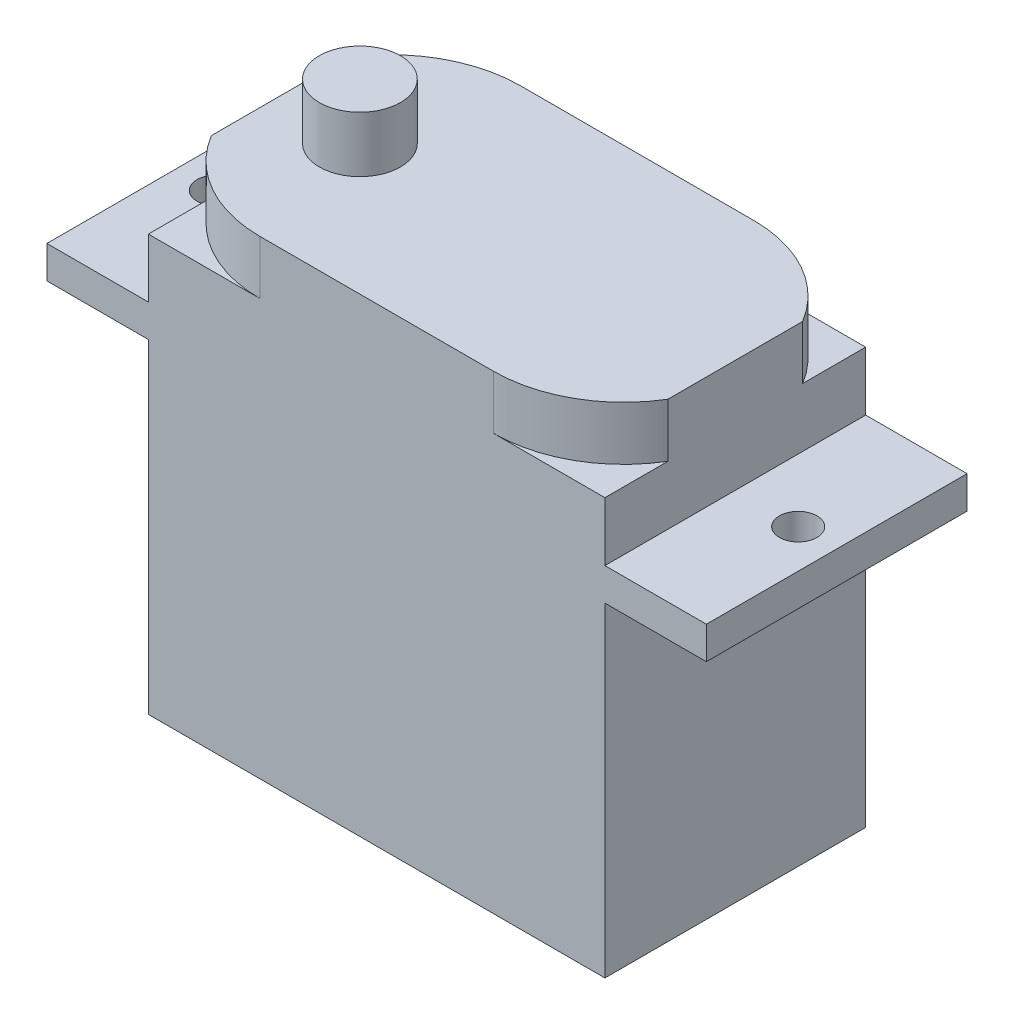
from build123d import *

# Parameters (mm, degrees)
ESQUISSE1_W      = 22.5
ESQUISSE1_H      = 20.5
EXTRUSION1_DEPTH = 12.85
EXTRUSION2_DEPTH = 2.65
ESQUISSE3_W      = 12.85
ESQUISSE3_H      = 1.6
EXTRUSION3_DEPTH = 5
ESQUISSE5_R      = 0.925
EXTRUSION5_DEPTH = 2.75
ESQUISSE4_R      = 2
EXTRUSION4_DEPTH = 2.75


with BuildPart() as part:
    # Esquisse1 → Extrusion1 (new body)
    with BuildSketch(Plane.XY):
        Rectangle(ESQUISSE1_W, ESQUISSE1_H)
    extrude(amount=EXTRUSION1_DEPTH)

    # Esquisse2 → Extrusion2 (add)
    with BuildSketch(Plane(origin=(0, 10.25, 0), x_dir=(1, 0, 0), z_dir=(0, 1, 0))):
        with BuildLine():
            Line((-5.75, 0), (5.75, 0))
            ThreePointArc((5.75, 0), (8.907662728, -0.829484734), (11.25, -3.103761526))
            Line((11.25, -3.103761526), (11.25, -9.746238474))
            ThreePointArc((11.25, -9.746238474), (8.907662728, -12.020515266), (5.75, -12.85))
            Line((5.75, -12.85), (-5.75, -12.85))
            ThreePointArc((-5.75, -12.85), (-8.907662728, -12.020515266), (-11.25, -9.746238474))
            Line((-11.25, -9.746238474), (-11.25, -3.103761526))
            ThreePointArc((-11.25, -3.103761526), (-8.907662728, -0.829484734), (-5.75, 0))
        make_face()
    extrude(amount=EXTRUSION2_DEPTH)

    # Esquisse3 → Extrusion3 (add)
    with BuildSketch(Plane.ZY.offset(11.25)):
        with Locations((6.425, 6.55)):
            Rectangle(ESQUISSE3_W, ESQUISSE3_H)
    extrusion3 = extrude(amount=EXTRUSION3_DEPTH)

    # Esquisse5 → Extrusion5 (cut)
    with BuildSketch(Plane(origin=(0, 7.35, 0), x_dir=(1, 0, 0), z_dir=(0, 1, 0))):
        with Locations(Location((-14.35, -6.425, 0), (0, 0, 270))):
            Circle(ESQUISSE5_R)
    extrusion5 = extrude(amount=-EXTRUSION5_DEPTH, mode=Mode.SUBTRACT)

    # Symétrie1: Extrusion3, Extrusion5 across plane
    add(extrusion3.mirror(Plane(origin=(0, 0, 0), x_dir=(0, 0, 1), z_dir=(1, 0, 0))))
    add(extrusion5.mirror(Plane(origin=(0, 0, 0), x_dir=(0, 0, 1), z_dir=(1, 0, 0))), mode=Mode.SUBTRACT)

    # Esquisse4 → Extrusion4 (add)
    with BuildSketch(Plane(origin=(0, 12.9, 0), x_dir=(1, 0, 0), z_dir=(0, 1, 0))):
        with Locations(Location((-7.25, -6.425, 0), (0, 0, 270))):
            Circle(ESQUISSE4_R)
    extrude(amount=EXTRUSION4_DEPTH)


solid = part.part
